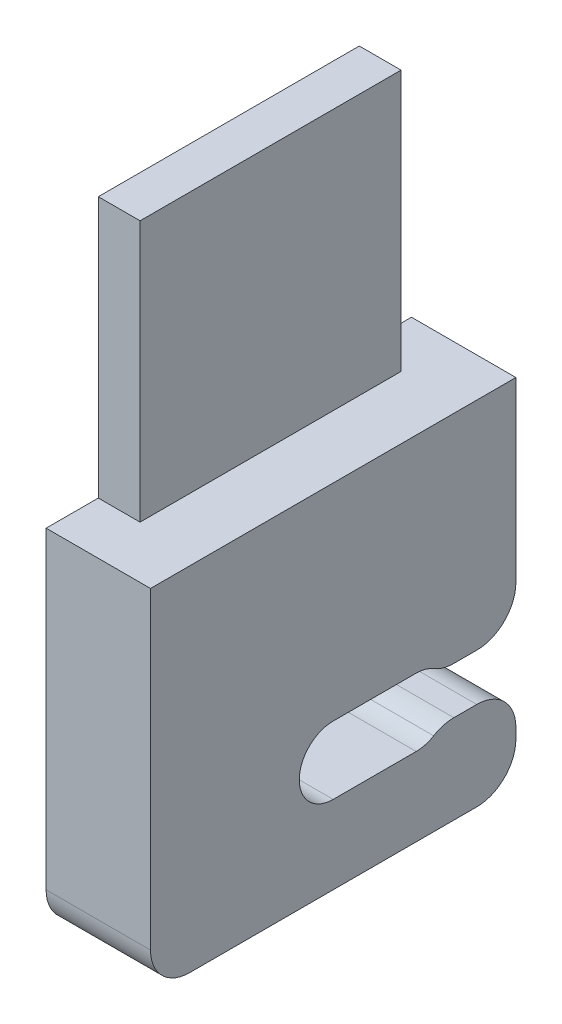
from build123d import *

# Parameters (mm, degrees)
SKETCH1_W           = 10
SKETCH1_H           = 10
BOSS_EXTRUDE1_DEPTH = 1.6
BOSS_EXTRUDE2_DEPTH = 10
SKETCH3_W           = 4
SKETCH3_H           = 2
BOSS_EXTRUDE3_DEPTH = 2
SKETCH4_W           = 4
SKETCH4_H           = 2
BOSS_EXTRUDE4_DEPTH = 2
BOSS_EXTRUDE5_DEPTH = 4
FILLET2_R           = 1.5


with BuildPart() as part:
    # Sketch1 → Boss-Extrude1 (new body)
    with BuildSketch(Plane(origin=(0, 0, 0), x_dir=(0, 0, -1), z_dir=(1, 0, 0))):
        with Locations((5, -5)):
            Rectangle(SKETCH1_W, SKETCH1_H)
    extrude(amount=BOSS_EXTRUDE1_DEPTH)

    # Sketch2 → Boss-Extrude2 (add)
    with BuildSketch(Plane.XY):
        Polygon((1.2, -12), (0, -12), (0, -10), (1.6, -10), (4, -10), (4, -12), (2.8, -12), align=None)
    extrude(amount=-BOSS_EXTRUDE2_DEPTH)

    # Sketch3 → Boss-Extrude3 (add)
    with BuildSketch(Plane.XY):
        with Locations((2, -11)):
            Rectangle(SKETCH3_W, SKETCH3_H)
    extrude(amount=BOSS_EXTRUDE3_DEPTH)

    # Sketch4 → Boss-Extrude4 (add)
    with BuildSketch(Plane(origin=(0, 0, -10), x_dir=(-1, 0, 0), z_dir=(0, 0, -1))):
        with Locations((-2, -11)):
            Rectangle(SKETCH4_W, SKETCH4_H)
    extrude(amount=BOSS_EXTRUDE4_DEPTH)

    # Sketch5 → Boss-Extrude5 (add)
    with BuildSketch(Plane(origin=(4, 0, 0), x_dir=(0, 0, -1), z_dir=(1, 0, 0))):
        with BuildLine():
            Line((12, -12), (-2, -12))
            Line((-2, -12), (-2, -16.665516671))
            Line((-2, -16.665516671), (-2, -18.3))
            Line((-2, -18.3), (-2, -20.1))
            Line((-2, -20.1), (-2, -22))
            ThreePointArc((-2, -22), (-1.560660172, -23.060660172), (-0.5, -23.5))
            Line((-0.5, -23.5), (10.5, -23.5))
            ThreePointArc((10.5, -23.5), (11.560660172, -23.060660172), (12, -22))
            Line((12, -22), (12, -20.1))
            Line((12, -20.1), (9.118083152, -20.1))
            ThreePointArc((9.118083152, -20.1), (8.689901951, -20.395826074), (8.18, -20.5))
            Line((8.18, -20.5), (5, -20.5))
            ThreePointArc((5, -20.5), (3.7, -19.2), (5, -17.9))
            Line((5, -17.9), (8.18, -17.9))
            ThreePointArc((8.18, -17.9), (8.689901951, -18.004173926), (9.118083152, -18.3))
            Line((9.118083152, -18.3), (12, -18.3))
            Line((12, -18.3), (12, -12))
        make_face()
    extrude(amount=-BOSS_EXTRUDE5_DEPTH)

    # Fillet2
    fillet2_edges = [part.edges().sort_by_distance(p)[0] for p in [
        (2, -18.3, -12),
        (2, -18.3, -9.118083152),
        (2, -20.1, -9.118083152),
        (2, -20.1, -12),
    ]]
    fillet(fillet2_edges, radius=FILLET2_R)


solid = part.part
